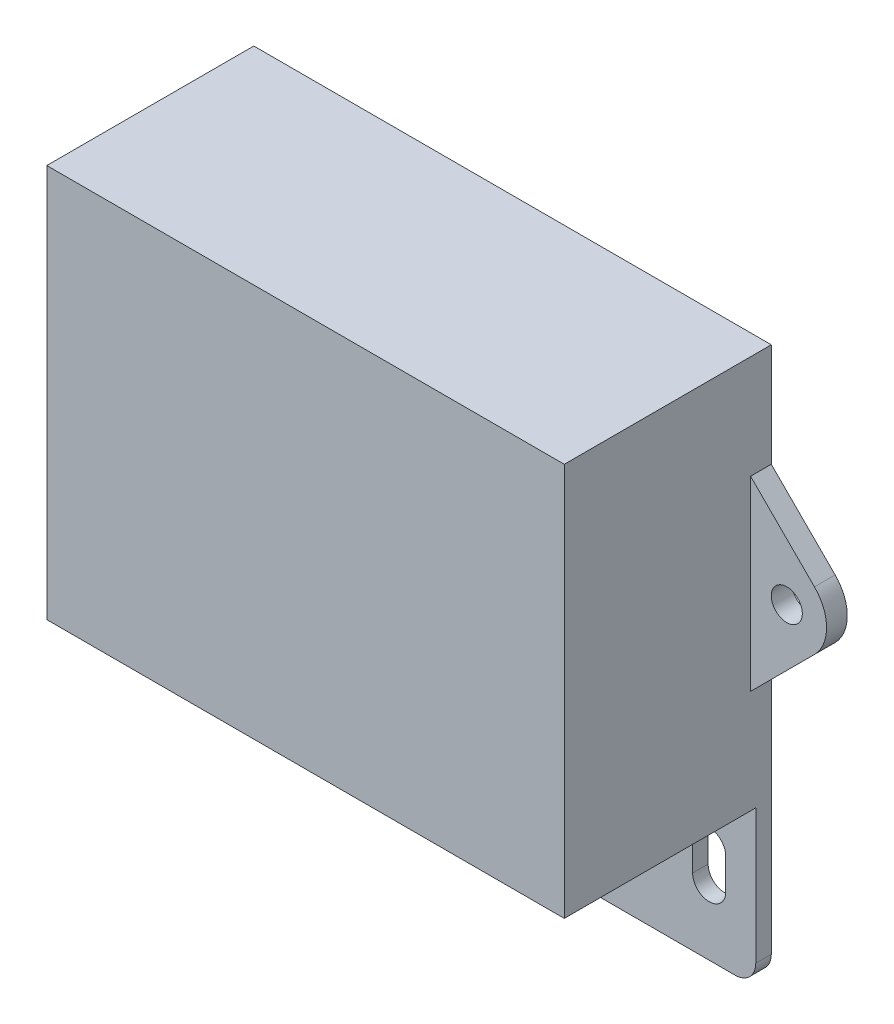
from build123d import *

# Parameters (mm, degrees)
ESQUISSE1_W             = 50
ESQUISSE1_H             = 38
BOSS_EXTRU_1_DEPTH      = 20
ESQUISSE2_W             = 50
ESQUISSE2_H             = 1.5
BOSS_EXTRU_2_DEPTH      = 15
CONG_1_R                = 2
ENL_V_MAT_EXTRU_1_DEPTH = 47.078736962
ESQUISSE4_R             = 1.5
BOSS_EXTRU_3_DEPTH      = 2
CONG_2_R                = 4


with BuildPart() as part:
    # Esquisse1 → Boss.-Extru.1 (new body)
    with BuildSketch(Plane.XY):
        Rectangle(ESQUISSE1_W, ESQUISSE1_H)
    extrude(amount=BOSS_EXTRU_1_DEPTH)

    # Esquisse2 → Boss.-Extru.2 (add)
    with BuildSketch(Plane(origin=(0, -19, 0), x_dir=(-1, 0, 0), z_dir=(0, -1, 0))):
        with Locations((0, -0.75)):
            Rectangle(ESQUISSE2_W, ESQUISSE2_H)
    extrude(amount=BOSS_EXTRU_2_DEPTH)

    # Congé1
    cong_1_edges = [part.edges().sort_by_distance(p)[0] for p in [
        (-25, -34, 0.75),
        (25, -34, 0.75),
    ]]
    fillet(cong_1_edges, radius=CONG_1_R)

    # Esquisse3 → Enlèv. mat.-Extru.1 (cut, through all)
    with BuildSketch(Plane.XY.offset(1.5)):
        with BuildLine():
            Line((-22.1, -24.5), (-22.1, -27.5))
            ThreePointArc((-22.1, -27.5), (-20.5, -29.1), (-18.9, -27.5))
            Line((-18.9, -27.5), (-18.9, -24.5))
            ThreePointArc((-18.9, -24.5), (-20.5, -22.9), (-22.1, -24.5))
        make_face()
        with BuildLine():
            Line((18.9, -24.5), (18.9, -27.5))
            ThreePointArc((18.9, -27.5), (20.5, -29.1), (22.1, -27.5))
            Line((22.1, -27.5), (22.1, -24.5))
            ThreePointArc((22.1, -24.5), (20.5, -22.9), (18.9, -24.5))
        make_face()
    extrude(amount=-ENL_V_MAT_EXTRU_1_DEPTH, mode=Mode.SUBTRACT)

    # Esquisse4 → Boss.-Extru.3 (add)
    # profile 1 of 2: a face of its own
    with BuildSketch(Plane(origin=(0, 0, 0), x_dir=(-1, 0, 0), z_dir=(0, 0, -1))):
        Polygon((-25, 9), (-34, 0), (-25, -9), align=None)
        with Locations((-28.5, 0)):
            Circle(ESQUISSE4_R, mode=Mode.SUBTRACT)
    # profile 2 of 2: a face of its own
    with BuildSketch(Plane(origin=(0, 0, 0), x_dir=(-1, 0, 0), z_dir=(0, 0, -1))):
        Polygon((25, -9), (34, 0), (25, 9), align=None)
        with Locations((28.5, 0)):
            Circle(ESQUISSE4_R, mode=Mode.SUBTRACT)
    extrude(amount=-BOSS_EXTRU_3_DEPTH)

    # Congé2
    cong_2_edges = [part.edges().sort_by_distance(p)[0] for p in [
        (34, 0, 1),
        (-34, 0, 1),
    ]]
    fillet(cong_2_edges, radius=CONG_2_R)


solid = part.part
